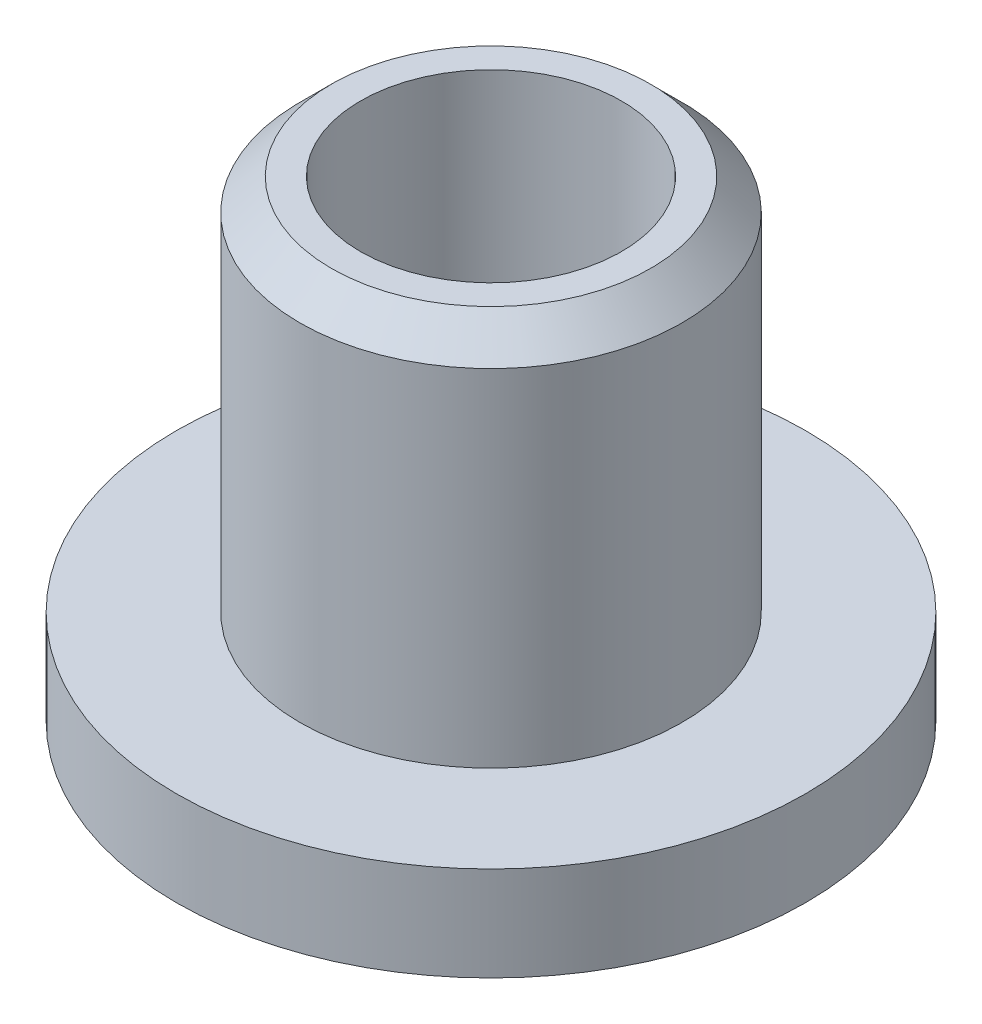
from build123d import *

# Parameters (mm, degrees)
SKIZZE1_R                       = 10
AUFSATZ_LINEAR_AUSTRAGEN1_DEPTH = 3
SKIZZE2_R                       = 6.075
AUFSATZ_LINEAR_AUSTRAGEN2_DEPTH = 12
SKIZZE3_R                       = 4.15
SCHNITT_LINEAR_AUSTRAGEN1_DEPTH = 21.615528128
FASE1_SIZE                      = 1


with BuildPart() as part:
    # Skizze1 → Aufsatz-Linear austragen1 (new body)
    with BuildSketch(Plane(origin=(0, 0, 0), x_dir=(1, 0, 0), z_dir=(0, 1, 0))):
        with Locations(Location((0, 0, 0), (0, 0, 270))):
            Circle(SKIZZE1_R)
    extrude(amount=AUFSATZ_LINEAR_AUSTRAGEN1_DEPTH)

    # Skizze2 → Aufsatz-Linear austragen2 (add)
    with BuildSketch(Plane(origin=(0, 3, 0), x_dir=(1, 0, 0), z_dir=(0, 1, 0))):
        with Locations(Location((0, 0, 0), (0, 0, 270))):
            Circle(SKIZZE2_R)
    extrude(amount=AUFSATZ_LINEAR_AUSTRAGEN2_DEPTH)

    # Skizze3 → Schnitt-Linear austragen1 (cut, through all)
    with BuildSketch(Plane(origin=(0, 15, 0), x_dir=(1, 0, 0), z_dir=(0, 1, 0))):
        with Locations(Location((0, 0, 0), (0, 0, 270))):
            Circle(SKIZZE3_R)
    extrude(amount=-SCHNITT_LINEAR_AUSTRAGEN1_DEPTH, mode=Mode.SUBTRACT)

    # Fase1
    fase1_edges = [part.edges().sort_by_distance(p)[0] for p in [
        (0, 0, -4.15),
        (0, 15, -6.075),
    ]]
    chamfer(fase1_edges, length=FASE1_SIZE)


solid = part.part
